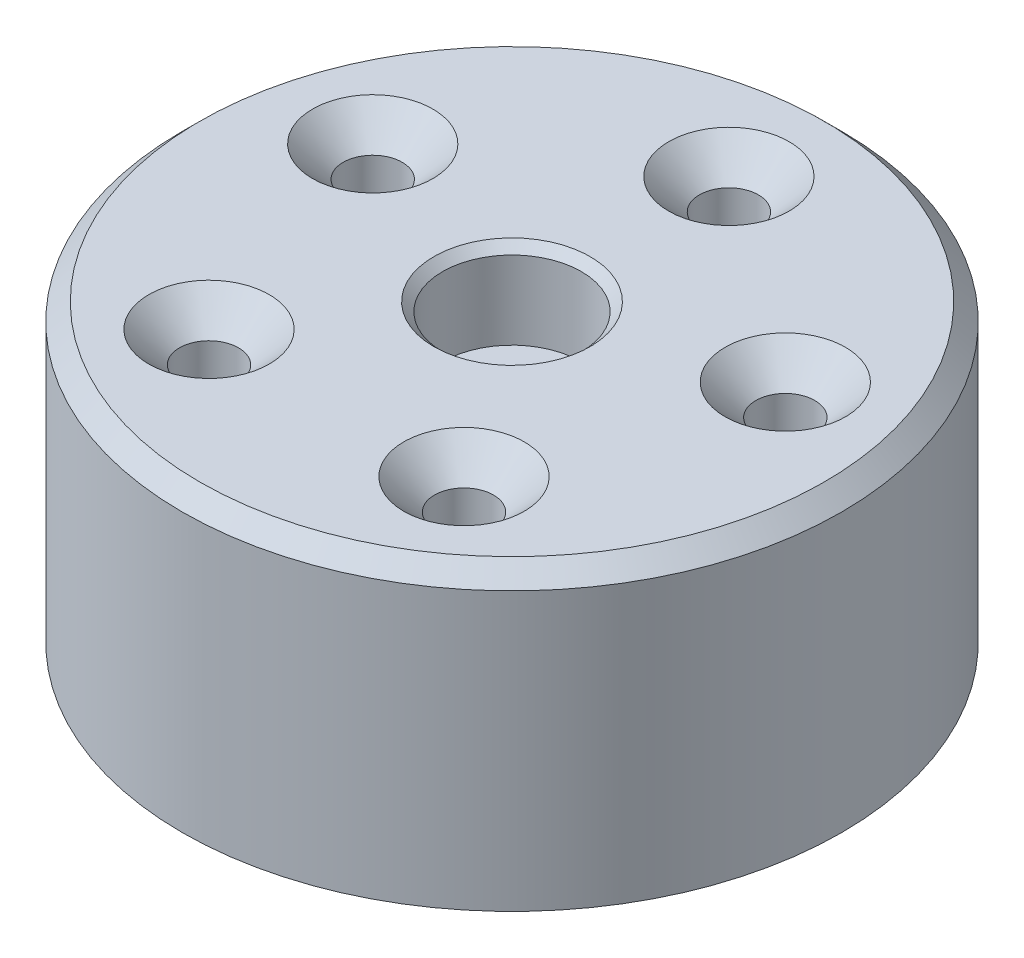
from build123d import *

# Parameters (mm, degrees)
CSK_FOR_M3_HEX_SOCKET_COUNTERSUNK_HEAD_S_D           = 3.4
CSK_FOR_M3_HEX_SOCKET_COUNTERSUNK_HEAD_S_CSINK_D     = 6.94
CSK_FOR_M3_HEX_SOCKET_COUNTERSUNK_HEAD_S_CSINK_ANGLE = 90
SKETCH6_R                                            = 7.5
CUT_EXTRUDE1_DEPTH                                   = 5
CHAMFER1_SIZE                                        = 3
CHAMFER2_SIZE                                        = 1
CHAMFER3_SIZE                                        = 0.5


with BuildPart() as part:
    # Sketch1 → Revolve1 (revolve)
    with BuildSketch(Plane.XY, mode=Mode.PRIVATE) as revolve1_sk:
        Polygon((17, 0), (19, 0), (19, 17), (4, 17), (4, 12), (0, 12), (0, 2), (17, 2), align=None)
    revolve(revolve1_sk.sketch.rotate(Axis((0, 0, 0), (0, 1, 0)), 90), axis=Axis((0, 0, 0), (0, 1, 0)))

    # CSK for M3 Hex Socket Countersunk Head Screw1 (through all)
    with Locations(Plane(origin=(0, 17, 0), x_dir=(1, 0, 0), z_dir=(0, 1, 0))):
        with Locations((-11.888206454, 3.86271243), (0, 12.5), (11.888206454, 3.86271243), (7.347315654, -10.11271243), (-7.347315654, -10.11271243)):
            CounterSinkHole(CSK_FOR_M3_HEX_SOCKET_COUNTERSUNK_HEAD_S_D / 2, CSK_FOR_M3_HEX_SOCKET_COUNTERSUNK_HEAD_S_CSINK_D / 2, counter_sink_angle=CSK_FOR_M3_HEX_SOCKET_COUNTERSUNK_HEAD_S_CSINK_ANGLE)

    # Sketch6 → Cut-Extrude1 (cut)
    with BuildSketch(Plane.XZ.offset(-2)):
        with Locations(Location((0, 0, 0), (0, 0, 270))):
            Circle(SKETCH6_R)
    extrude(amount=-CUT_EXTRUDE1_DEPTH, mode=Mode.SUBTRACT)

    # Chamfer1
    chamfer1_edges = [part.edges().sort_by_distance(p)[0] for p in [
        (0, 7, 7.5),
    ]]
    chamfer(chamfer1_edges, length=CHAMFER1_SIZE)

    # Chamfer2
    chamfer2_edges = [part.edges().sort_by_distance(p)[0] for p in [
        (0, 17, 19),
    ]]
    chamfer(chamfer2_edges, length=CHAMFER2_SIZE)

    # Chamfer3
    chamfer3_edges = [part.edges().sort_by_distance(p)[0] for p in [
        (0, 17, 4),
    ]]
    chamfer(chamfer3_edges, length=CHAMFER3_SIZE)


solid = part.part
